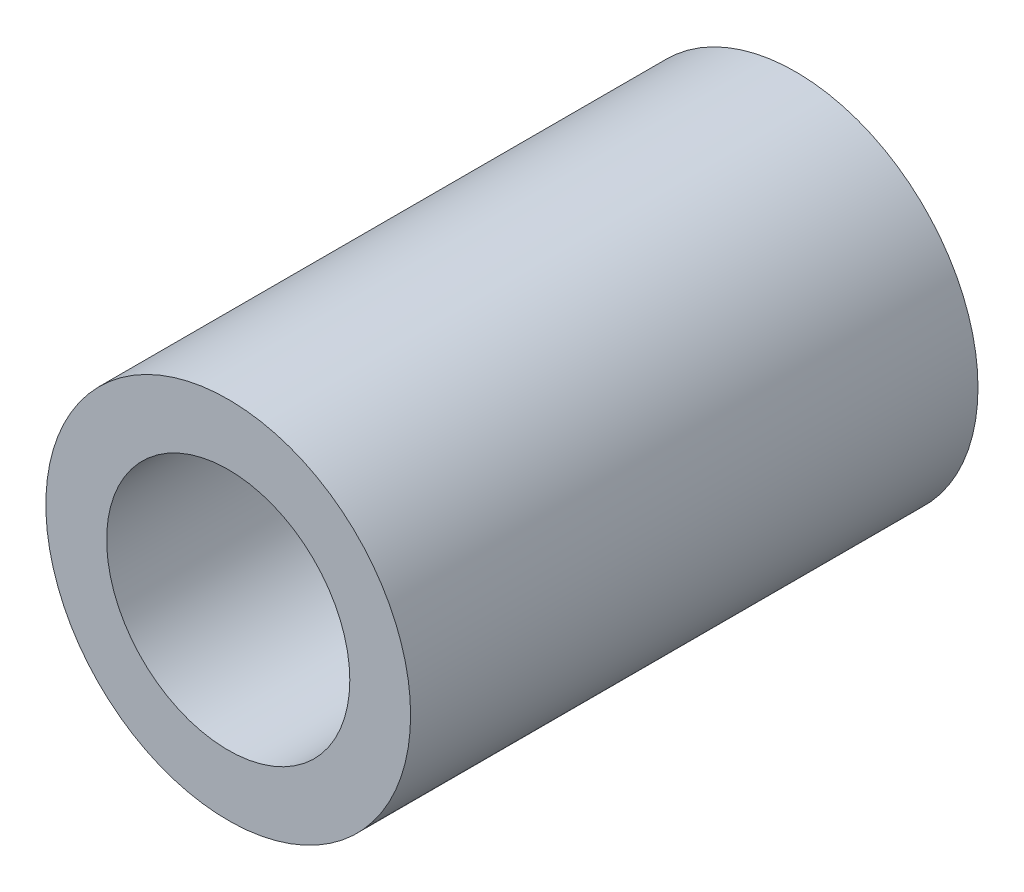
from build123d import *

# Parameters (mm, degrees)
SKETCH_1_R      = 18
SKETCH_1_R_2    = 12
EXTRUDE_1_DEPTH = 56


with BuildPart() as part:
    # Эскиз1 → Бобышка-Вытянуть1 (new body)
    with BuildSketch(Plane.XY):
        Circle(SKETCH_1_R)
        Circle(SKETCH_1_R_2, mode=Mode.SUBTRACT)
    extrude(amount=-EXTRUDE_1_DEPTH)


solid = part.part
